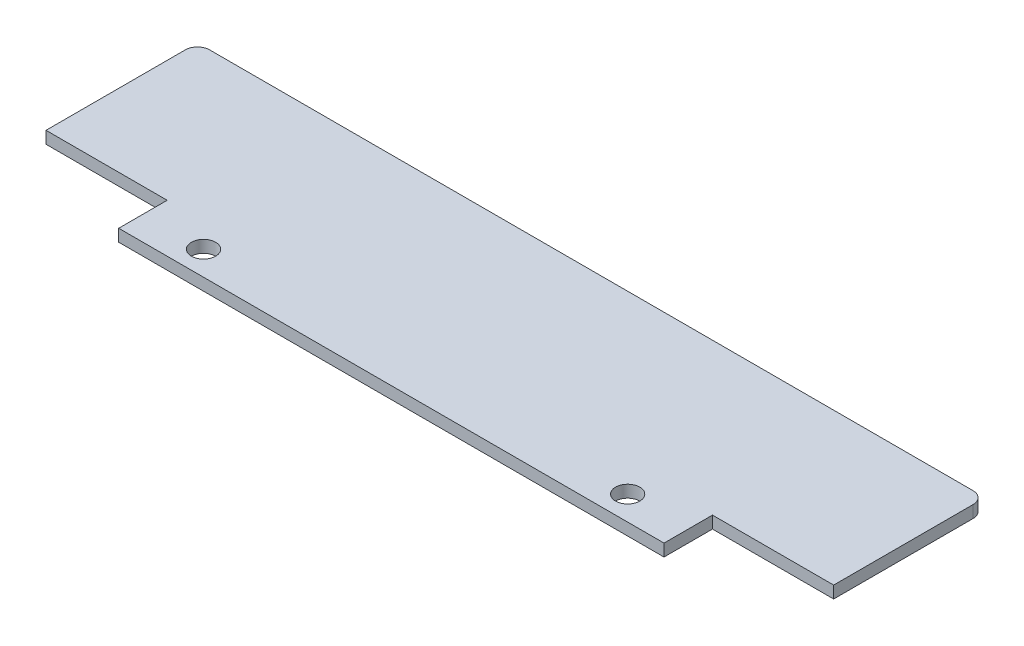
from build123d import *

# Parameters (mm, degrees)
SKETCH1_R           = 2
BOSS_EXTRUDE1_DEPTH = 2
FILLET1_R           = 2


with BuildPart() as part:
    # Sketch1 → Boss-Extrude1 (new body)
    with BuildSketch(Plane(origin=(0, 0, 0), x_dir=(1, 0, 0), z_dir=(0, 1, 0))):
        Polygon((65, 12.5), (65, -12.5), (45, -12.5), (45, -20.5), (-45, -20.5), (-45, -12.5), (-65, -12.5), (-65, 12.5), align=None)
        with Locations(Location((-35, -16.5, 0), (0, 0, 270))):
            Circle(SKETCH1_R, mode=Mode.SUBTRACT)
        with Locations(Location((35, -16.5, 0), (0, 0, 270))):
            Circle(SKETCH1_R, mode=Mode.SUBTRACT)
    extrude(amount=BOSS_EXTRUDE1_DEPTH)

    # Fillet1
    fillet1_edges = [part.edges().sort_by_distance(p)[0] for p in [
        (-65, 1, -12.5),
        (65, 1, -12.5),
    ]]
    fillet(fillet1_edges, radius=FILLET1_R)


solid = part.part
